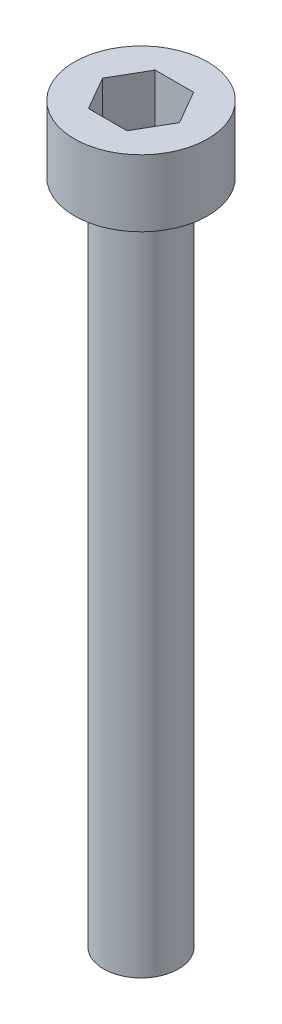
from build123d import *

# Parameters (mm, degrees)
ESQUISSE1_W             = 2.25
ESQUISSE1_H             = 40
ENL_V_MAT_EXTRU_1_DEPTH = 3


with BuildPart() as part:
    # Esquisse1 → Révolution1 (revolve)
    with BuildSketch(Plane.XY, mode=Mode.PRIVATE) as r_volution1_sk:
        Rectangle(ESQUISSE1_W, ESQUISSE1_H)
        Polygon((-2.875, 20), (-1.125, 20), (1.125, 20), (1.125, 24), (-2.875, 24), align=None)
    revolve(r_volution1_sk.sketch.rotate(Axis((1.125, -20, 0), (0, 1, 0)), 270), axis=Axis((1.125, -20, 0), (0, 1, 0)))

    # Esquisse2 → Enlèv. mat.-Extru.1 (cut)
    with BuildSketch(Plane(origin=(0, 24, 0), x_dir=(1, 0, 0), z_dir=(0, 1, 0))):
        Polygon((3.434401077, 0), (2.279700538, 2), (-0.029700538, 2), (-1.184401077, 0), (-0.029700538, -2), (2.279700538, -2), align=None)
    extrude(amount=-ENL_V_MAT_EXTRU_1_DEPTH, mode=Mode.SUBTRACT)


solid = part.part
